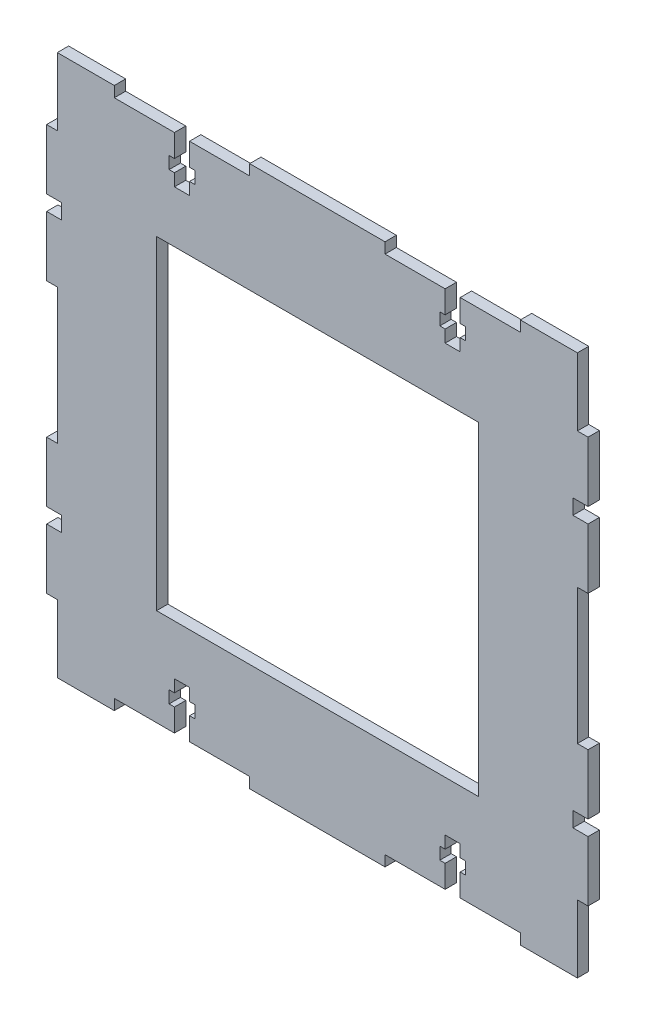
from build123d import *

# Parameters (mm, degrees)
SKETCH1_W           = 89.973098965
SKETCH1_H           = 90.646237782
BOSS_EXTRUDE1_DEPTH = 3.175


with BuildPart() as part:
    # Sketch1 → Boss-Extrude1 (new body)
    with BuildSketch(Plane.XY):
        Polygon((157.378148634, 154.39750188), (157.378148634, 135.470394989), (154.39750188, 135.470394989), (154.39750188, 118.65457955), (158.620084782, 118.65457955), (158.620084782, 116.543288099), (158.620084782, 114.431996648), (154.39750188, 114.431996648), (154.39750188, 97.616181208), (157.378148634, 97.616181208), (157.378148634, 59.761967427), (154.39750188, 59.761967427), (154.39750188, 42.946151987), (158.620084782, 42.946151987), (158.620084782, 40.834860536), (158.620084782, 38.723569085), (154.39750188, 38.723569085), (154.39750188, 21.907753645), (157.378148634, 21.907753645), (157.378148634, 2.980646754), (173.324608771, 2.980646754), (173.324608771, 5.961293509), (190.14042421, 5.961293509), (190.14042421, 12.270329139), (188.650100833, 12.270329139), (188.650100833, 15.698072907), (190.14042421, 15.698072907), (190.14042421, 19.125816674), (194.363007113, 19.125816674), (194.363007113, 15.698072907), (195.85333049, 15.698072907), (195.85333049, 12.270329139), (194.363007113, 12.270329139), (194.363007113, 5.961293509), (211.178822552, 5.961293509), (211.178822552, 2.980646754), (249.033036334, 2.980646754), (249.033036334, 5.961293509), (265.848851773, 5.961293509), (265.848851773, 12.270329139), (264.358528396, 12.270329139), (264.358528396, 15.698072907), (265.848851773, 15.698072907), (265.848851773, 19.125816674), (270.071434675, 19.125816674), (270.071434675, 15.698072907), (271.561758053, 15.698072907), (271.561758053, 12.270329139), (270.071434675, 12.270329139), (270.071434675, 5.961293509), (286.887250115, 5.961293509), (286.887250115, 2.980646754), (302.833710251, 2.980646754), (302.833710251, 21.907753645), (305.814357006, 21.907753645), (305.814357006, 38.723569085), (301.591774104, 38.723569085), (301.591774104, 40.834860536), (301.591774104, 42.946151987), (305.814357006, 42.946151987), (305.814357006, 59.761967427), (302.833710251, 59.761967427), (302.833710251, 97.616181208), (305.814357006, 97.616181208), (305.814357006, 114.431996648), (301.591774104, 114.431996648), (301.591774104, 116.543288099), (301.591774104, 118.65457955), (305.814357006, 118.65457955), (305.814357006, 135.470394989), (302.833710251, 135.470394989), (302.833710251, 154.39750188), (286.887250115, 154.39750188), (286.887250115, 151.416855126), (270.071434675, 151.416855126), (270.071434675, 145.107819495), (271.561758053, 145.107819495), (271.561758053, 141.680075728), (270.071434675, 141.680075728), (270.071434675, 138.25233196), (265.848851773, 138.25233196), (265.848851773, 141.680075728), (264.358528396, 141.680075728), (264.358528396, 145.107819495), (265.848851773, 145.107819495), (265.848851773, 151.416855126), (249.033036334, 151.416855126), (249.033036334, 154.39750188), (211.178822552, 154.39750188), (211.178822552, 151.416855126), (194.363007113, 151.416855126), (194.363007113, 145.107819495), (195.85333049, 145.107819495), (195.85333049, 141.680075728), (194.363007113, 141.680075728), (194.363007113, 138.25233196), (190.14042421, 138.25233196), (190.14042421, 141.680075728), (188.650100833, 141.680075728), (188.650100833, 145.107819495), (190.14042421, 145.107819495), (190.14042421, 151.416855126), (173.324608771, 151.416855126), (173.324608771, 154.39750188), align=None)
        with Locations((230.132306119, 78.423957663)):
            Rectangle(SKETCH1_W, SKETCH1_H, mode=Mode.SUBTRACT)
    extrude(amount=BOSS_EXTRUDE1_DEPTH)


solid = part.part
